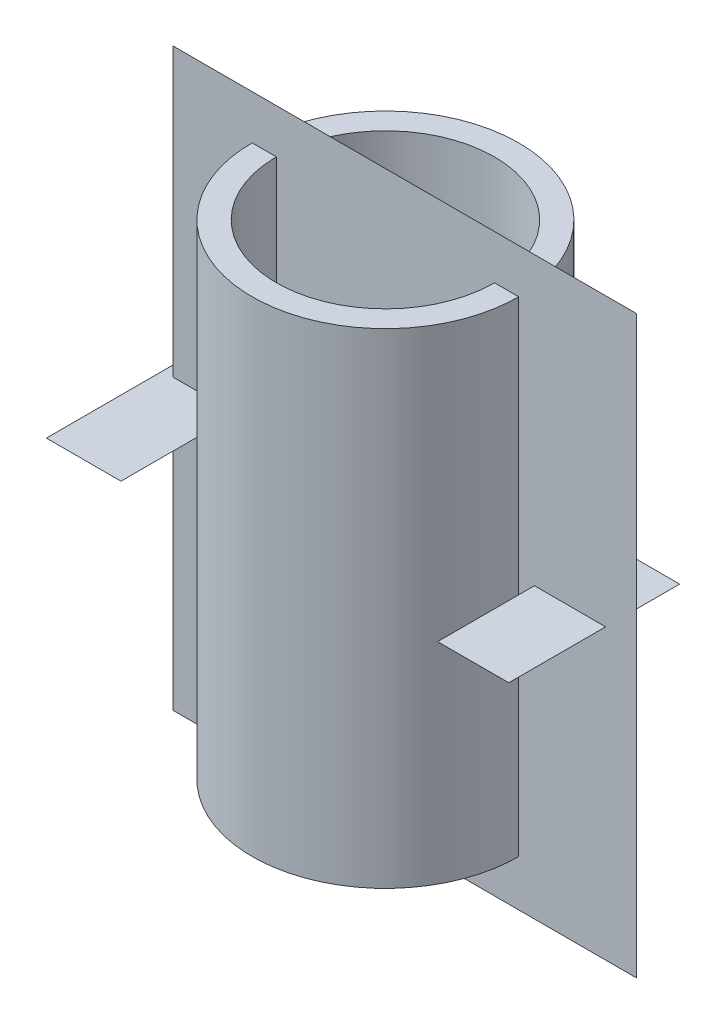
from build123d import *

# Parameters (mm, degrees)
SKETCH_1_W = 10
SKETCH_1_H = 200


with BuildPart() as part:
    # Эскиз1 → Повернуть1 (revolve)
    with BuildSketch(Plane.XY, mode=Mode.PRIVATE) as revolve_1_sk:
        with Locations((50, 0)):
            Rectangle(SKETCH_1_W, SKETCH_1_H)
    revolve(revolve_1_sk.sketch.rotate(Axis((0, -110.603092707, 0), (0, 1, 0)), 90), axis=Axis((0, -110.603092707, 0), (0, 1, 0)))


solid = part.part
